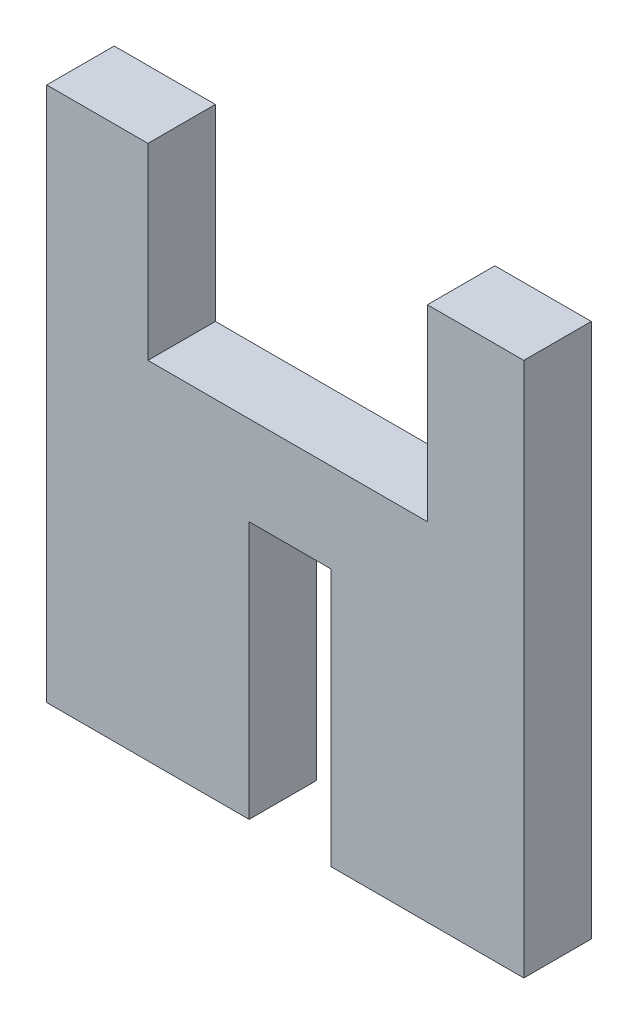
from build123d import *

# Parameters (mm, degrees)
EXTRUDE_1_DEPTH = 3.4


with BuildPart() as part:
    # 草图1 → 凸台-拉伸1 (new body)
    with BuildSketch(Plane.XY):
        Polygon((-14.328571429, 13.964285714), (-14.328571429, -12.992857143), (-4.128571429, -12.992857143), (-4.128571429, 0), (0, 0), (0, -12.992857143), (9.714285714, -12.992857143), (9.714285714, 13.964285714), (4.857142857, 13.964285714), (4.857142857, 4.492857143), (-9.228571429, 4.492857143), (-9.228571429, 13.964285714), align=None)
    extrude(amount=EXTRUDE_1_DEPTH)


solid = part.part
